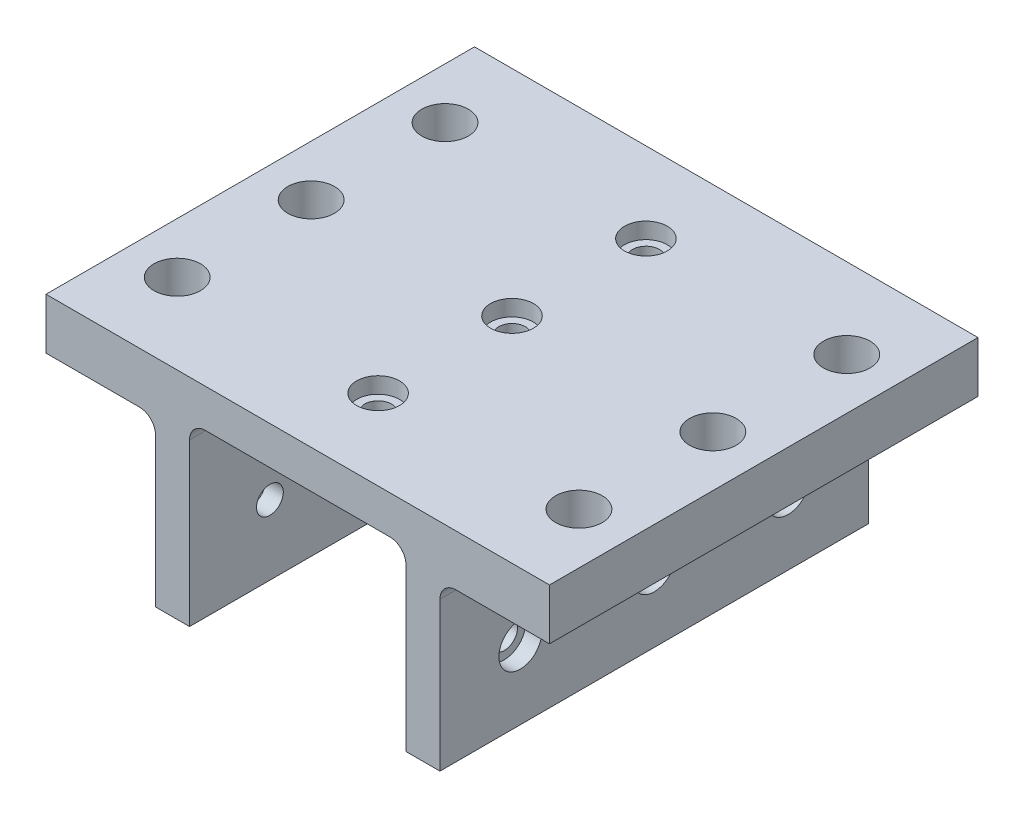
from build123d import *

# Parameters (mm, degrees)
EXTRUDE1_DEPTH            = 80
M8_7_8_7_DIAMETER_HOLE1_D = 8.7
HOLE1_D                   = 5
HOLE1_CBORE_D             = 8
HOLE1_CBORE_DEPTH         = 3
HOLE2_D                   = 5
HOLE2_DEPTH               = 7
HOLE2_CBORE_D             = 8
HOLE2_CBORE_DEPTH         = 3


with BuildPart() as part:
    # Sketch2 → Extrude1 (new body)
    with BuildSketch(Plane.XY):
        with BuildLine():
            Line((153.422248213, 153.636884267), (59.422248213, 153.636884267))
            Line((59.422248213, 153.636884267), (59.422248213, 144.111884267))
            Line((59.422248213, 144.111884267), (76.872248213, 144.111884267))
            ThreePointArc((76.872248213, 144.111884267), (78.993568556, 143.233204611), (79.872248213, 141.111884267))
            Line((79.872248213, 141.111884267), (79.872248213, 113.299884267))
            Line((79.872248213, 113.299884267), (86.222248213, 113.299884267))
            Line((86.222248213, 113.299884267), (86.222248213, 138.349884267))
            Line((86.222248213, 138.349884267), (86.222248213, 143.499884267))
            ThreePointArc((86.222248213, 143.499884267), (87.100927869, 145.621204611), (89.222248213, 146.499884267))
            Line((89.222248213, 146.499884267), (94.372248213, 146.499884267))
            Line((94.372248213, 146.499884267), (118.472248213, 146.499884267))
            Line((118.472248213, 146.499884267), (123.622248213, 146.499884267))
            ThreePointArc((123.622248213, 146.499884267), (125.743568556, 145.621204611), (126.622248213, 143.499884267))
            Line((126.622248213, 143.499884267), (126.622248213, 138.349884267))
            Line((126.622248213, 138.349884267), (126.622248213, 113.299884267))
            Line((126.622248213, 113.299884267), (132.972248213, 113.299884267))
            Line((132.972248213, 113.299884267), (132.972248213, 141.111884267))
            ThreePointArc((132.972248213, 141.111884267), (133.850927869, 143.233204611), (135.972248213, 144.111884267))
            Line((135.972248213, 144.111884267), (153.422248213, 144.111884267))
            Line((153.422248213, 144.111884267), (153.422248213, 153.636884267))
        make_face()
    extrude(amount=EXTRUDE1_DEPTH)

    # M8.7 (8.7) Diameter Hole1 (through all)
    with Locations(Plane(origin=(68.922248213, 153.636884267, 65), x_dir=(1, 0, 0), z_dir=(0, 1, 0))):
        with Locations((0, 0), (0, 25), (0, 50), (75, 50), (75, 25), (75, 0)):
            Hole(M8_7_8_7_DIAMETER_HOLE1_D / 2)

    # Hole1 (through all)
    with Locations(Plane(origin=(106.422248213, 153.636884267, 65), x_dir=(1, 0, 0), z_dir=(0, 1, 0))):
        with Locations((0, 0), (0, 25), (0, 50)):
            CounterBoreHole(HOLE1_D / 2, HOLE1_CBORE_D / 2, HOLE1_CBORE_DEPTH)

    # Hole2
    with Locations(Plane(origin=(132.972248213, 126.296884267, 65), x_dir=(0, 0, 1), z_dir=(1, 0, 0))):
        with Locations((0, 0), (-25, 0), (-50, 0)):
            hole2 = CounterBoreHole(HOLE2_D / 2, HOLE2_CBORE_D / 2, HOLE2_CBORE_DEPTH, depth=HOLE2_DEPTH)

    # Mirror1: Hole2 across plane
    add(hole2.mirror(Plane.ZY.offset(-106.422248213)), mode=Mode.SUBTRACT)


solid = part.part
